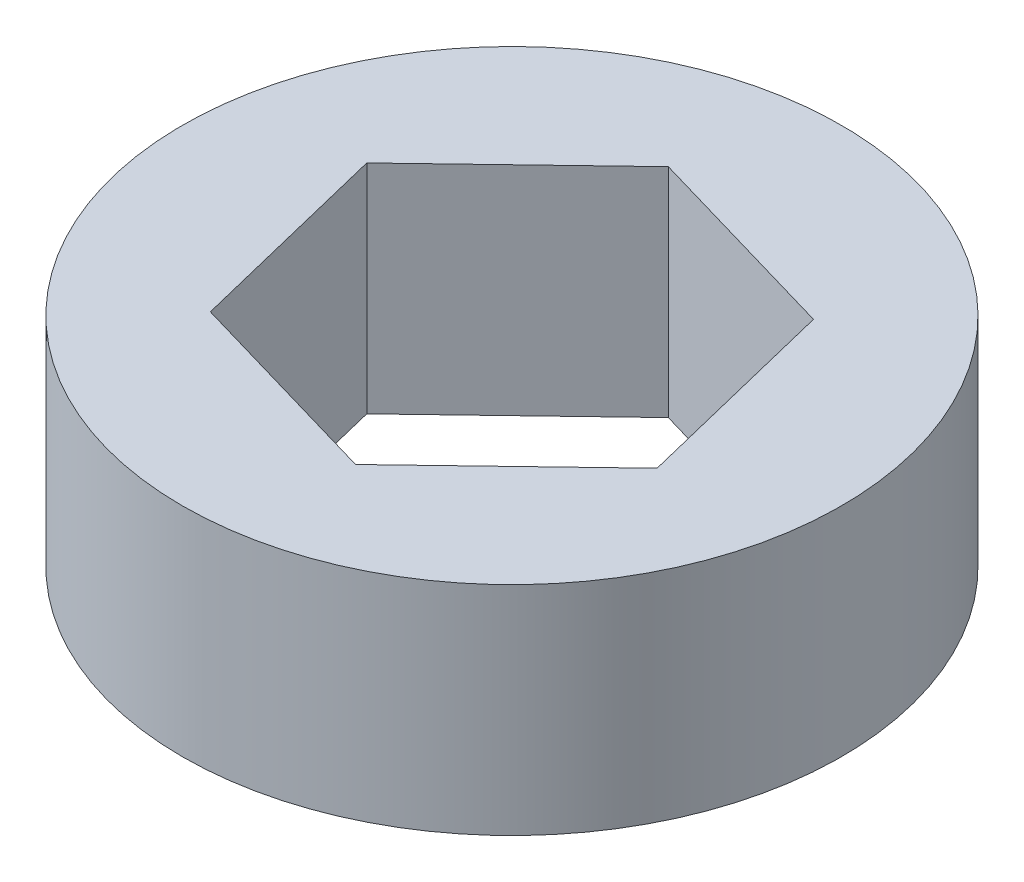
from build123d import *

# Parameters (mm, degrees)
SKETCH1_R           = 4.55
BOSS_EXTRUDE1_DEPTH = 3
CUT_EXTRUDE1_DEPTH  = 15


with BuildPart() as part:
    # Sketch1 → Boss-Extrude1 (new body)
    with BuildSketch(Plane(origin=(0, 0, 0), x_dir=(1, 0, 0), z_dir=(0, 1, 0))):
        with Locations(Location((0, 0, 0), (0, 0, 270))):
            Circle(SKETCH1_R)
    extrude(amount=BOSS_EXTRUDE1_DEPTH)

    # Sketch2 → Cut-Extrude1 (cut)
    with BuildSketch(Plane(origin=(0, 3, 0), x_dir=(1, 0, 0), z_dir=(0, 1, 0))):
        Polygon((-2.126350259, -2.036819721), (0.700762492, -2.859883202), (2.827112751, -0.823063481), (2.126350259, 2.036819721), (-0.700762492, 2.859883202), (-2.827112751, 0.823063481), align=None)
    extrude(amount=-CUT_EXTRUDE1_DEPTH, mode=Mode.SUBTRACT)


solid = part.part
